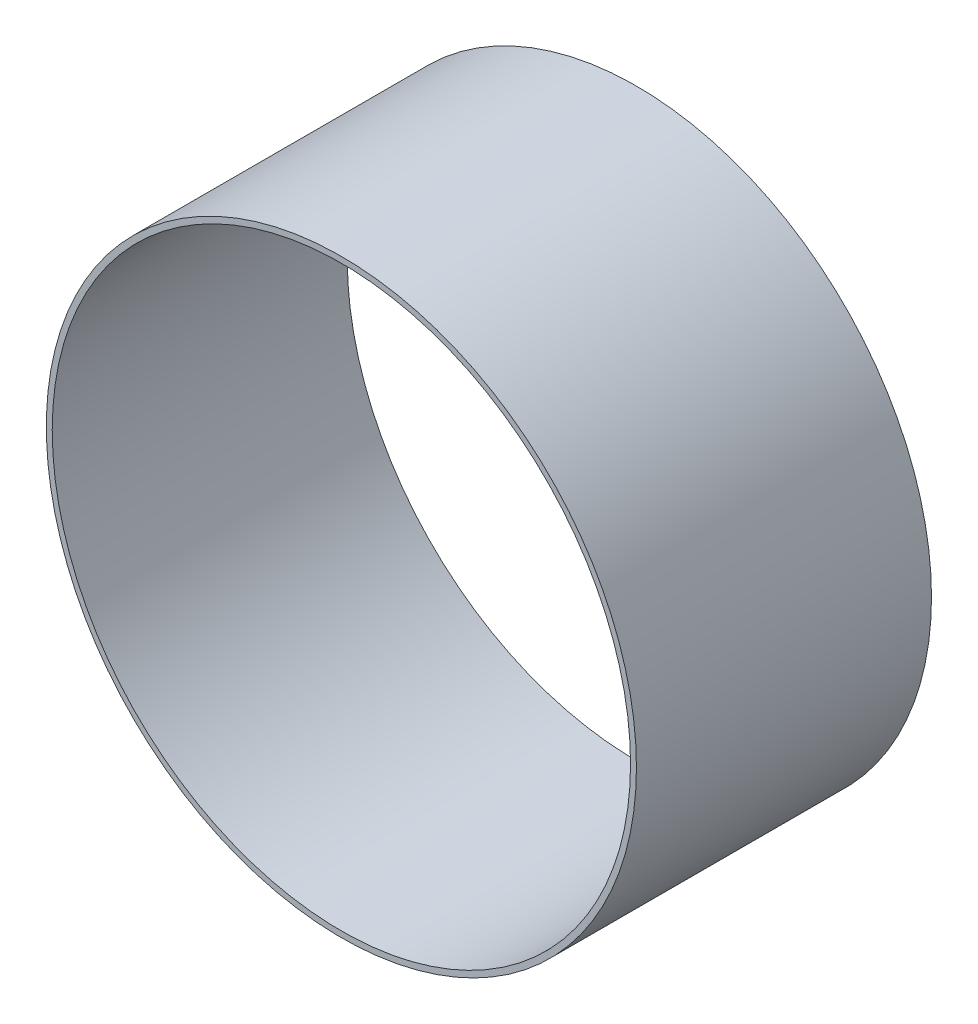
from build123d import *

# Parameters (mm, degrees)
ESQUISSE1_R        = 50
ESQUISSE1_R_2      = 49
BOSS_EXTRU_1_DEPTH = 50


with BuildPart() as part:
    # Esquisse1 → Boss.-Extru.1 (new body)
    with BuildSketch(Plane.XY):
        Circle(ESQUISSE1_R)
        Circle(ESQUISSE1_R_2, mode=Mode.SUBTRACT)
    extrude(amount=BOSS_EXTRU_1_DEPTH)


solid = part.part
